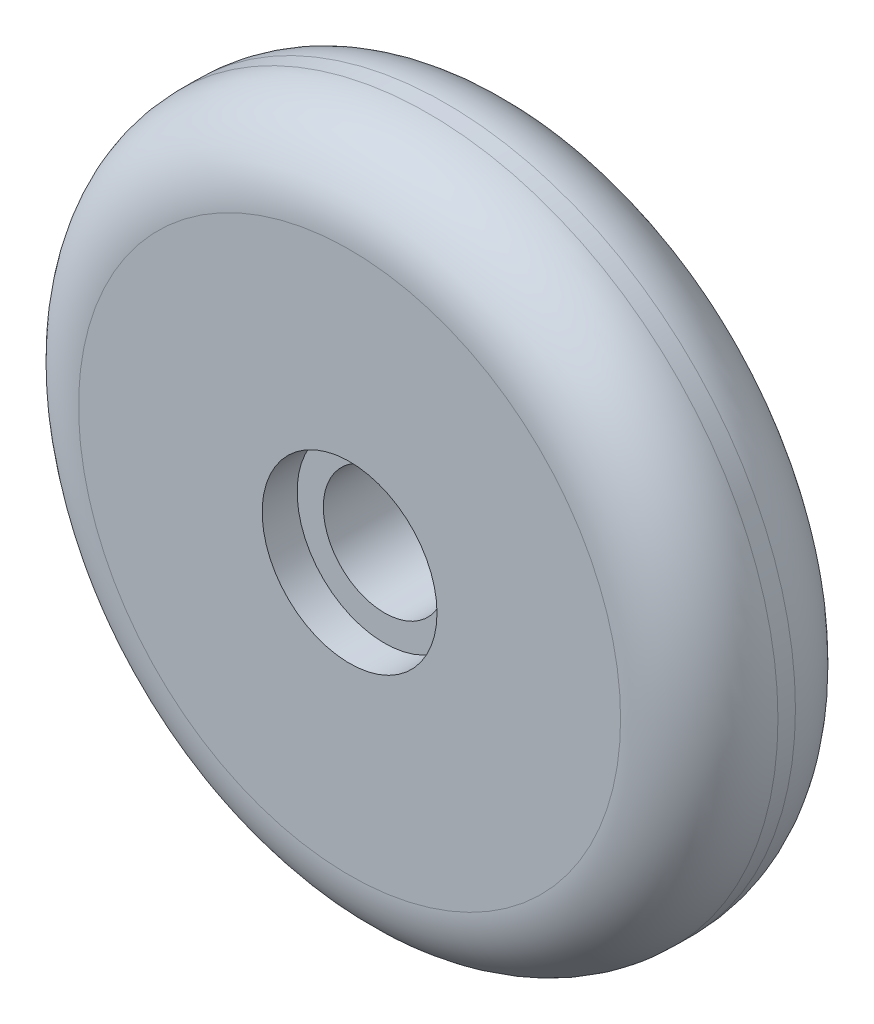
from build123d import *

# Parameters (mm, degrees)
SKETCH1_R           = 20
SKETCH1_R_2         = 3.5
BOSS_EXTRUDE1_DEPTH = 10
FILLET1_R           = 4.5
SKETCH2_R           = 5
CUT_EXTRUDE1_DEPTH  = 2
CUT_EXTRUDE2_START  = -2
SKETCH5_R           = 5
CUT_EXTRUDE2_DEPTH  = 2


with BuildPart() as part:
    # Sketch1 → Boss-Extrude1 (new body)
    with BuildSketch(Plane.XY):
        Circle(SKETCH1_R)
        Circle(SKETCH1_R_2, mode=Mode.SUBTRACT)
    extrude(amount=BOSS_EXTRUDE1_DEPTH)

    # Fillet1
    fillet1_edges = [part.edges().sort_by_distance(p)[0] for p in [
        (-20, 0, 0),
        (-20, 0, 10),
    ]]
    fillet(fillet1_edges, radius=FILLET1_R)

    # Sketch2 → Cut-Extrude1 (cut)
    with BuildSketch(Plane(origin=(0, 0, 0), x_dir=(-1, 0, 0), z_dir=(0, 0, -1))):
        Circle(SKETCH2_R)
    extrude(amount=-CUT_EXTRUDE1_DEPTH, mode=Mode.SUBTRACT)

    # Sketch5 → Cut-Extrude2 (cut)
    with BuildSketch(Plane.XY.offset(10).offset(CUT_EXTRUDE2_START)):
        with Locations(Location((0, 0, 0), (0, 0, 180))):
            Circle(SKETCH5_R)
    extrude(amount=CUT_EXTRUDE2_DEPTH, mode=Mode.SUBTRACT)


solid = part.part
